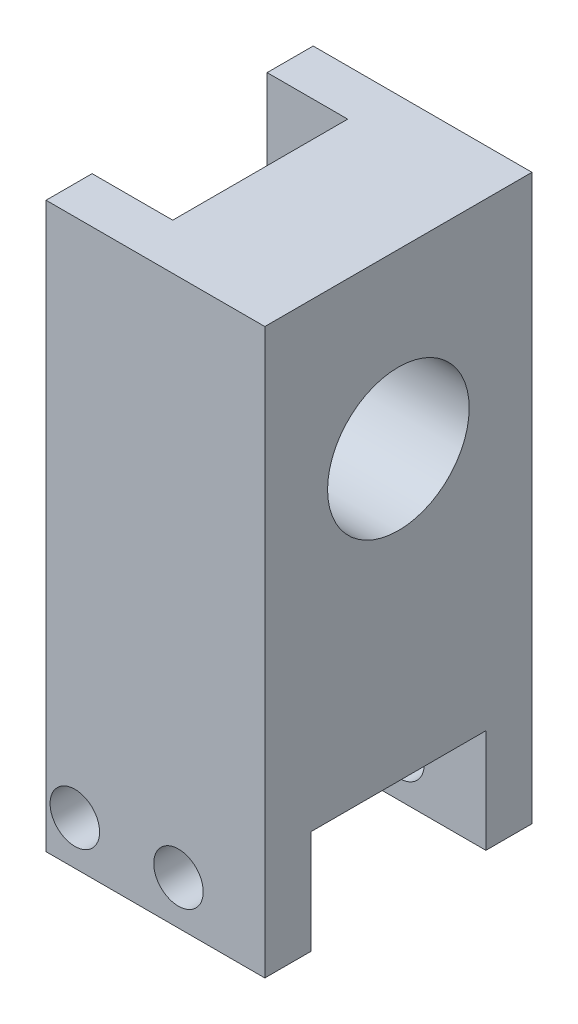
from build123d import *

# Parameters (mm, degrees)
GUIDED_START                               = 38.4
SKETCH1_W                                  = 12
SKETCH1_H                                  = 40
GUIDED_BRIDGE_WITH_ROD_COUPLING_SEAT_DEPTH = 23.2
LOWER_START                                = 38.4
SKETCH2_W                                  = 19
SKETCH2_H                                  = 49
LOWER_RACK_LAP_DEPTH                       = 4
UPPER_START                                = 57.6
SKETCH3_W                                  = 19
SKETCH3_H                                  = 49
UPPER_RACK_LAP_DEPTH                       = 4
M4_START                                   = 38.4
SKETCH4_R                                  = 2.15
M4_JOINT_BOLT_CLEARANCE_DEPTH              = 23.2
RADIAL_START                               = 65
SKETCH5_R                                  = 6.15
RADIAL_FLOATING_STUD_CLEARANCE_DEPTH       = 12


with BuildPart() as part:
    # Sketch1 → Guided bridge with rod coupling seat (new body)
    with BuildSketch(Plane.XY.offset(GUIDED_START)):
        with Locations((71, 64)):
            Rectangle(SKETCH1_W, SKETCH1_H)
    extrude(amount=GUIDED_BRIDGE_WITH_ROD_COUPLING_SEAT_DEPTH)

    # Sketch2 → Lower rack lap (add)
    with BuildSketch(Plane.XY.offset(LOWER_START)):
        with Locations((67.5, 59.5)):
            Rectangle(SKETCH2_W, SKETCH2_H)
    extrude(amount=LOWER_RACK_LAP_DEPTH)

    # Sketch3 → Upper rack lap (add)
    with BuildSketch(Plane.XY.offset(UPPER_START)):
        with Locations((67.5, 59.5)):
            Rectangle(SKETCH3_W, SKETCH3_H)
    extrude(amount=UPPER_RACK_LAP_DEPTH)

    # Sketch4 → M4 joint bolt clearance (cut)
    with BuildSketch(Plane.XY.offset(M4_START)):
        with Locations((60.5, 38.8)):
            Circle(SKETCH4_R)
        with Locations((69.5, 38.8)):
            Circle(SKETCH4_R)
    extrude(amount=M4_JOINT_BOLT_CLEARANCE_DEPTH, mode=Mode.SUBTRACT)

    # Sketch5 → Radial floating stud clearance (cut)
    with BuildSketch(Plane(origin=(0, 0, 0), x_dir=(0, 0, -1), z_dir=(1, 0, 0)).offset(RADIAL_START)):
        with Locations((-50, 69)):
            Circle(SKETCH5_R)
    extrude(amount=RADIAL_FLOATING_STUD_CLEARANCE_DEPTH, mode=Mode.SUBTRACT)


solid = part.part
